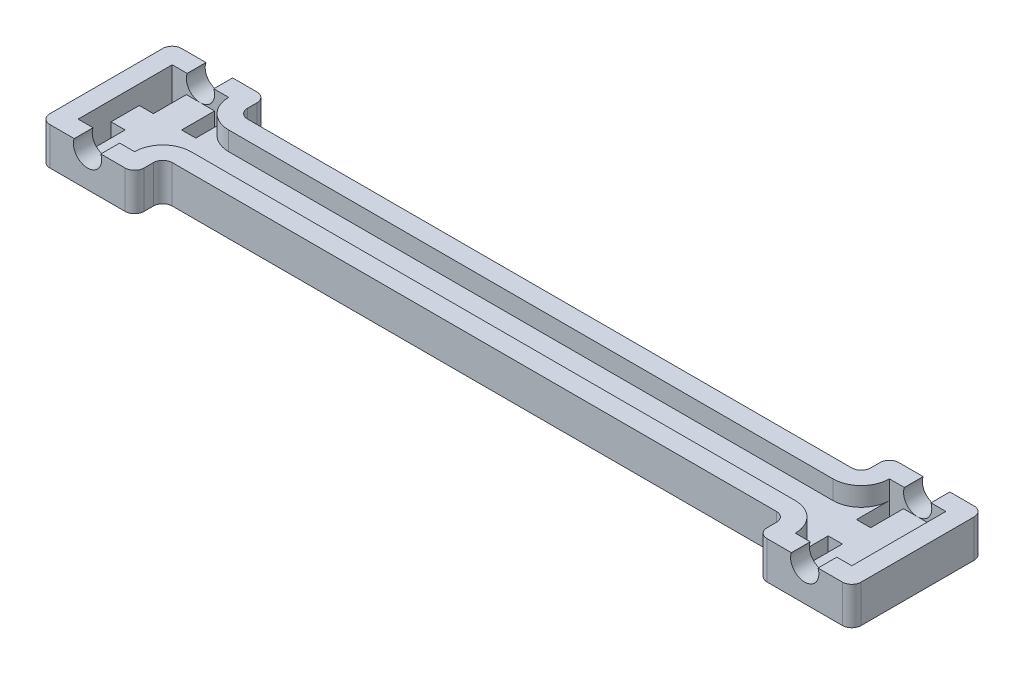
from build123d import *

# Parameters (mm, degrees)
BOSS_EXTRUDE1_DEPTH  = 2
FILLET1_R            = 1
SKETCH2_W            = 1.5
SKETCH2_H            = 3.5
CUT_EXTRUDE1_DEPTH   = 44.710525048
BOSS_EXTRUDE2_START  = 2
BOSS_EXTRUDE2_DEPTH  = 2
SKETCH6_R            = 1.5
CUT_EXTRUDE2_DEPTH   = 14
FILLET1_OF_MIRROR1_R = 1


with BuildPart() as part:
    # Sketch1 → Boss-Extrude1 (new body)
    with BuildSketch(Plane(origin=(0, 0, 0), x_dir=(1, 0, 0), z_dir=(0, 1, 0))):
        Polygon((0, -4), (0, 4), (33.1, 4), (33.1, 7), (43.1, 7), (43.1, -7), (33.1, -7), (33.1, -4), align=None)
    boss_extrude1 = extrude(amount=BOSS_EXTRUDE1_DEPTH)

    # Fillet1
    fillet1_edges = [part.edges().sort_by_distance(p)[0] for p in [
        (33.1, 1, -4),
        (33.1, 1, -7),
        (43.1, 1, -7),
        (43.1, 1, 7),
        (33.1, 1, 7),
        (33.1, 1, 4),
    ]]
    fillet(fillet1_edges, radius=FILLET1_R)

    # Sketch2 → Cut-Extrude1 (cut, through all)
    with BuildSketch(Plane(origin=(0, 2, 0), x_dir=(1, 0, 0), z_dir=(0, 1, 0))):
        with Locations((35.85, -3.25)):
            Rectangle(SKETCH2_W, SKETCH2_H)
        with Locations((40.35, 3.25)):
            Rectangle(SKETCH2_W, SKETCH2_H)
        with Locations((40.35, -3.25)):
            Rectangle(SKETCH2_W, SKETCH2_H)
        with Locations((35.85, 3.25)):
            Rectangle(SKETCH2_W, SKETCH2_H)
    cut_extrude1 = extrude(amount=-CUT_EXTRUDE1_DEPTH, mode=Mode.SUBTRACT)

    # Sketch5 → Boss-Extrude2 (add)
    with BuildSketch(Plane(origin=(0, 2, 0), x_dir=(1, 0, 0), z_dir=(0, 1, 0)).offset(BOSS_EXTRUDE2_START)):
        with BuildLine():
            Line((0, -2), (32.1, -2))
            ThreePointArc((32.1, -2), (34.221320344, -2.878679656), (35.1, -5))
            Line((35.1, -5), (41.1, -5))
            Line((41.1, -5), (41.1, 5))
            Line((41.1, 5), (35.1, 5))
            ThreePointArc((35.1, 5), (34.221320344, 2.878679656), (32.1, 2))
            Line((32.1, 2), (0, 2))
            Line((0, 2), (0, 4))
            Line((0, 4), (32.1, 4))
            ThreePointArc((32.1, 4), (32.807106781, 4.292893219), (33.1, 5))
            Line((33.1, 5), (33.1, 6))
            ThreePointArc((33.1, 6), (33.392893219, 6.707106781), (34.1, 7))
            Line((34.1, 7), (42.1, 7))
            ThreePointArc((42.1, 7), (42.807106781, 6.707106781), (43.1, 6))
            Line((43.1, 6), (43.1, -6))
            ThreePointArc((43.1, -6), (42.807106781, -6.707106781), (42.1, -7))
            Line((42.1, -7), (34.1, -7))
            ThreePointArc((34.1, -7), (33.392893219, -6.707106781), (33.1, -6))
            Line((33.1, -6), (33.1, -5))
            ThreePointArc((33.1, -5), (32.807106781, -4.292893219), (32.1, -4))
            Line((32.1, -4), (0, -4))
            Line((0, -4), (0, -2))
        make_face()
    boss_extrude2 = extrude(amount=-BOSS_EXTRUDE2_DEPTH)

    # Sketch6 → Cut-Extrude2 (cut)
    with BuildSketch(Plane.XY.offset(7)):
        with Locations((38.1, 3.5)):
            Circle(SKETCH6_R)
    cut_extrude2 = extrude(amount=-CUT_EXTRUDE2_DEPTH, mode=Mode.SUBTRACT)

    # Mirror1: Boss-Extrude1, Cut-Extrude1, Boss-Extrude2, Cut-Extrude2 across plane
    add(boss_extrude1.mirror(Plane(origin=(0, 0, 0), x_dir=(0, 0, 1), z_dir=(1, 0, 0))))
    add(cut_extrude1.mirror(Plane(origin=(0, 0, 0), x_dir=(0, 0, 1), z_dir=(1, 0, 0))), mode=Mode.SUBTRACT)
    add(boss_extrude2.mirror(Plane(origin=(0, 0, 0), x_dir=(0, 0, 1), z_dir=(1, 0, 0))))
    add(cut_extrude2.mirror(Plane(origin=(0, 0, 0), x_dir=(0, 0, 1), z_dir=(1, 0, 0))), mode=Mode.SUBTRACT)

    # Fillet1 of Mirror1
    fillet1_of_mirror1_edges = [part.edges().sort_by_distance(p)[0] for p in [
        (-33.1, 1, -4),
        (-33.1, 1, -7),
        (-43.1, 1, -7),
        (-43.1, 1, 7),
        (-33.1, 1, 7),
        (-33.1, 1, 4),
    ]]
    fillet(fillet1_of_mirror1_edges, radius=FILLET1_OF_MIRROR1_R)


solid = part.part
